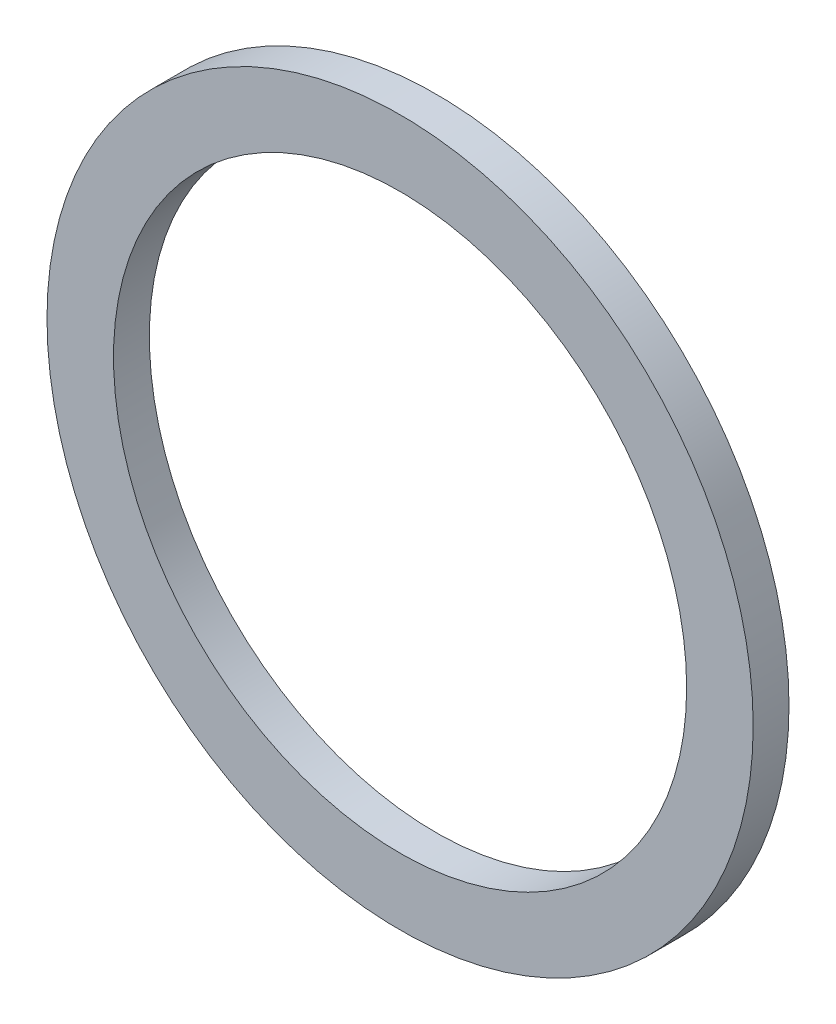
from build123d import *

# Parameters (mm, degrees)
SKETCH1_R           = 17.25
SKETCH1_R_2         = 14
BOSS_EXTRUDE1_DEPTH = 1.75


with BuildPart() as part:
    # Sketch1 → Boss-Extrude1 (new body)
    with BuildSketch(Plane.XY):
        Circle(SKETCH1_R)
        Circle(SKETCH1_R_2, mode=Mode.SUBTRACT)
    extrude(amount=BOSS_EXTRUDE1_DEPTH)


solid = part.part
